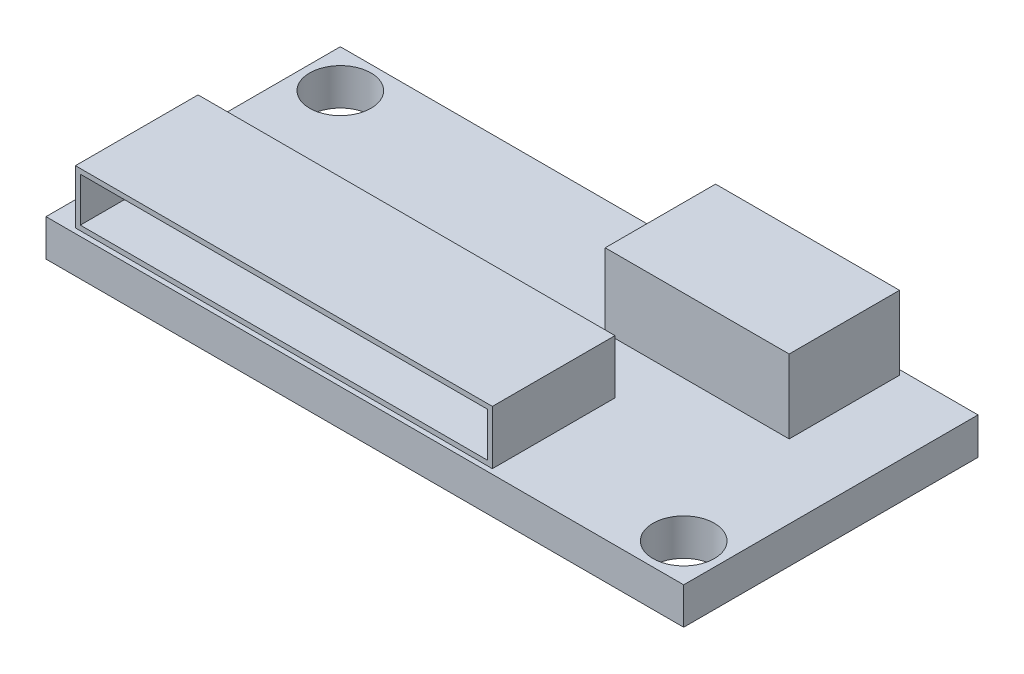
from build123d import *

# Parameters (mm, degrees)
SKETCH1_W           = 26
SKETCH1_H           = 12
SKETCH1_R           = 1.25
BOSS_EXTRUDE1_DEPTH = 1.5
SKETCH2_W           = 17
SKETCH2_H           = 5
BOSS_EXTRUDE2_DEPTH = 2.2
SKETCH2_3_W         = 7.5
SKETCH2_3_H         = 4.5
BOSS_EXTRUDE3_DEPTH = 3
SKETCH3_W           = 7.1
SKETCH3_H           = 2.6
CUT_EXTRUDE1_DEPTH  = 4.3
SKETCH4_W           = 16.6
SKETCH4_H           = 1.8
CUT_EXTRUDE2_DEPTH  = 4.8
SKETCH5_W           = 6.5
SKETCH5_H           = 4
BOSS_EXTRUDE4_DEPTH = 0.8


with BuildPart() as part:
    # Sketch1 → Boss-Extrude1 (new body)
    with BuildSketch(Plane(origin=(0, 0, 0), x_dir=(1, 0, 0), z_dir=(0, 1, 0))):
        with Locations((13, 6)):
            Rectangle(SKETCH1_W, SKETCH1_H)
        with Locations(Location((1.55, 10.45, 0), (0, 0, 270))):
            Circle(SKETCH1_R, mode=Mode.SUBTRACT)
        with Locations(Location((24.45, 1.55, 0), (0, 0, 270))):
            Circle(SKETCH1_R, mode=Mode.SUBTRACT)
    extrude(amount=BOSS_EXTRUDE1_DEPTH)

    # Sketch2 → Boss-Extrude2 (add)
    with BuildSketch(Plane(origin=(0, 1.5, 0), x_dir=(1, 0, 0), z_dir=(0, 1, 0))):
        with Locations((9.5, 2.7)):
            Rectangle(SKETCH2_W, SKETCH2_H)
    extrude(amount=BOSS_EXTRUDE2_DEPTH)

    # Sketch2<3> → Boss-Extrude3 (add)
    with BuildSketch(Plane(origin=(0, 1.5, 0), x_dir=(1, 0, 0), z_dir=(0, 1, 0))):
        with Locations((19.25, 9.55)):
            Rectangle(SKETCH2_3_W, SKETCH2_3_H)
    extrude(amount=BOSS_EXTRUDE3_DEPTH)

    # Sketch3 → Cut-Extrude1 (cut)
    with BuildSketch(Plane(origin=(0, 0, -11.8), x_dir=(-1, 0, 0), z_dir=(0, 0, -1))):
        with Locations((-19.25, 3)):
            Rectangle(SKETCH3_W, SKETCH3_H)
    extrude(amount=-CUT_EXTRUDE1_DEPTH, mode=Mode.SUBTRACT)

    # Sketch4 → Cut-Extrude2 (cut)
    with BuildSketch(Plane.XY.offset(-0.2)):
        with Locations((9.5, 2.6)):
            Rectangle(SKETCH4_W, SKETCH4_H)
    extrude(amount=-CUT_EXTRUDE2_DEPTH, mode=Mode.SUBTRACT)

    # Sketch5 → Boss-Extrude4 (add)
    with BuildSketch(Plane.XZ):
        with Locations((9.25, -8.6)):
            Rectangle(SKETCH5_W, SKETCH5_H)
    extrude(amount=BOSS_EXTRUDE4_DEPTH)


solid = part.part
